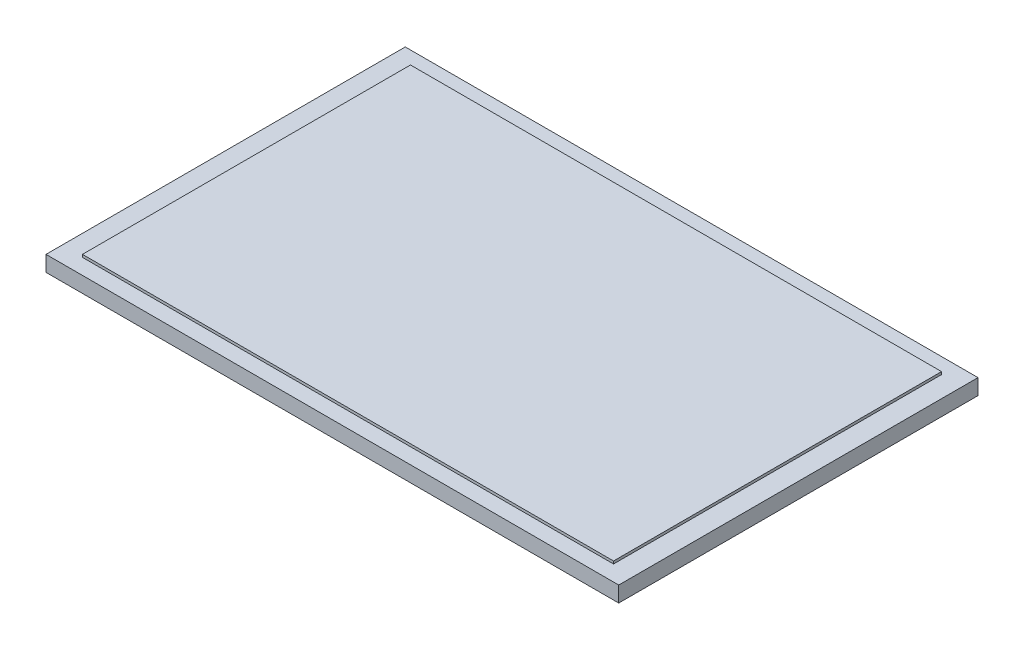
from build123d import *

# Parameters (mm, degrees)
SKETCH1_W           = 110
SKETCH1_H           = 69
BOSS_EXTRUDE3_DEPTH = 3
SKETCH2_W           = 102
SKETCH2_H           = 63
BOSS_EXTRUDE4_DEPTH = 0.5


with BuildPart() as part:
    # Sketch1 → Boss-Extrude3 (new body)
    with BuildSketch(Plane(origin=(0, 0, 0), x_dir=(1, 0, 0), z_dir=(0, 1, 0))):
        Rectangle(SKETCH1_W, SKETCH1_H)
    extrude(amount=BOSS_EXTRUDE3_DEPTH)

    # Sketch2 → Boss-Extrude4 (add)
    with BuildSketch(Plane(origin=(0, 3, 0), x_dir=(1, 0, 0), z_dir=(0, 1, 0))):
        Rectangle(SKETCH2_W, SKETCH2_H)
    extrude(amount=BOSS_EXTRUDE4_DEPTH)


solid = part.part
